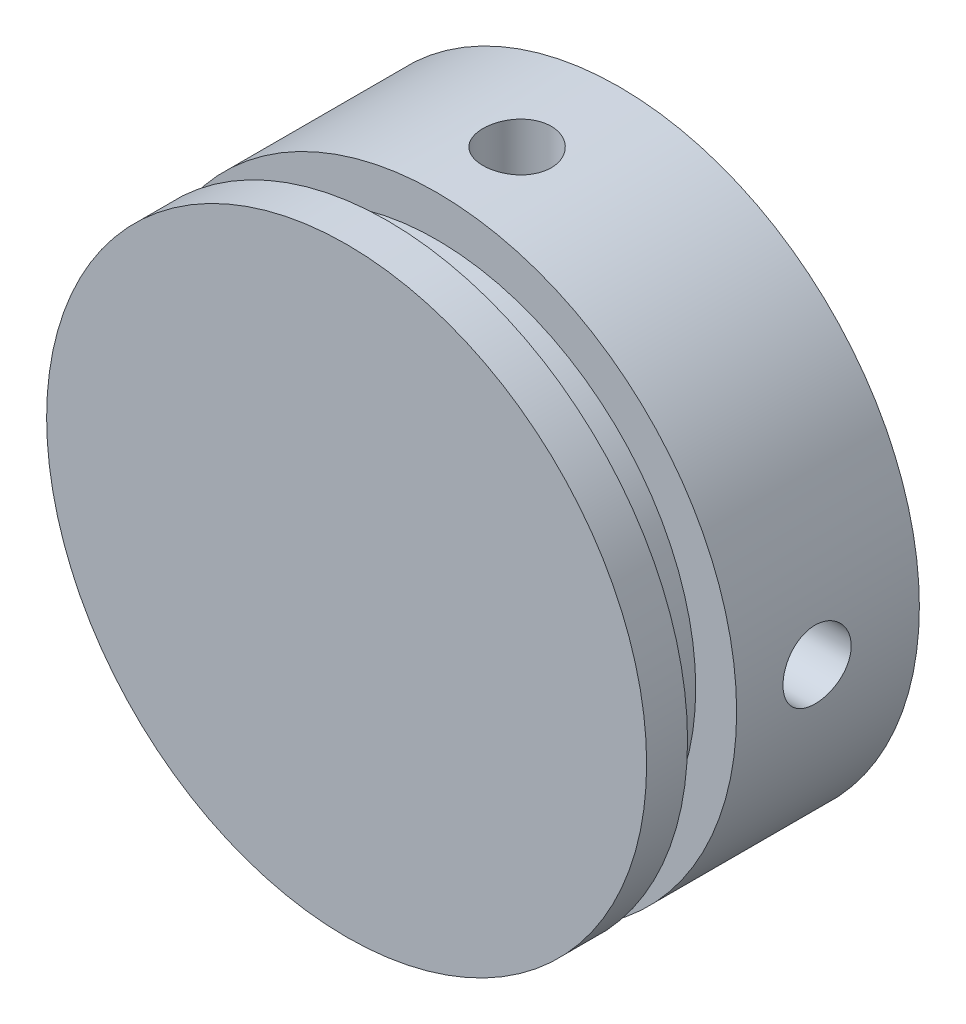
from build123d import *

# Parameters (mm, degrees)
CORTE_EXTRUS_O1_REACH = 55.104
ESBO_O3_R             = 2.5
PADR_OCIRCULAR1_COUNT = 4


with BuildPart() as part:
    # Esboço1 → Revolução1 (revolve)
    with BuildSketch(Plane(origin=(0, 0, 0), x_dir=(1, 0, 0), z_dir=(0, 1, 0))):
        Polygon((0, 0), (-22, 0), (-22, 3), (-19, 3), (-19, 6.6), (-22, 6.6), (-22, 20), (-15, 20), (-15, 7.5), (0, 7.5), align=None)
    revolve(axis=Axis((0, 0, 0), (0, 0, -1)))

    # Esboço3 → Corte-extrusão1 (cut, up to next)
    with BuildSketch(Plane.ZY.offset(22), mode=Mode.PRIVATE) as corte_extrus_o1_sk1:
        with Locations((-12.5, 0)):
            Circle(ESBO_O3_R)
    corte_extrus_o1_tool1 = extrude(corte_extrus_o1_sk1.sketch, amount=-CORTE_EXTRUS_O1_REACH, mode=Mode.PRIVATE) & part.part
    corte_extrus_o1 = corte_extrus_o1_tool1.solids().sort_by_distance((-22, 0, -12.5))[0]
    add(corte_extrus_o1, mode=Mode.SUBTRACT)

    # PadrãoCircular1: Corte-extrusão1 ×4 about axis
    padr_ocircular1_axis = Axis((0, 0, -20), (0, 0, 1))
    for i in range(1, PADR_OCIRCULAR1_COUNT):
        add(corte_extrus_o1.rotate(padr_ocircular1_axis, i * 360 / PADR_OCIRCULAR1_COUNT), mode=Mode.SUBTRACT)


solid = part.part
